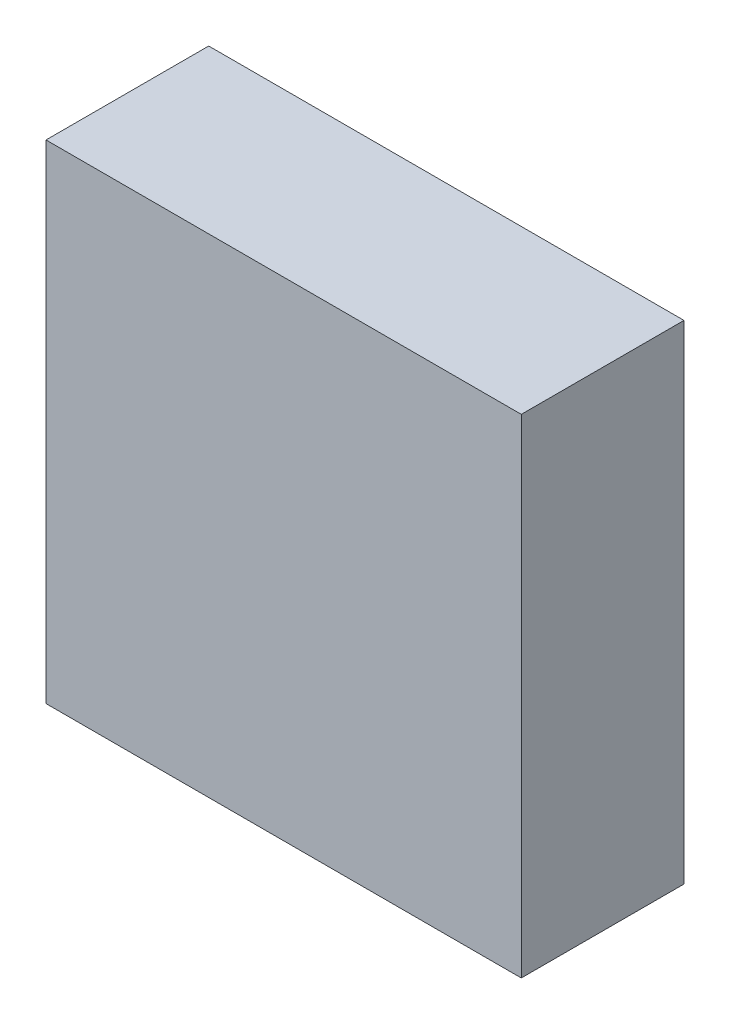
from build123d import *

# Parameters (mm, degrees)
SKETCH1_W               = 2.921
SKETCH1_H               = 3
COMPONENT_OUTLINE_DEPTH = 1


with BuildPart() as part:
    # Sketch1 → Component_Outline (new body)
    with BuildSketch(Plane.XY):
        with Locations((0.0381, 0)):
            Rectangle(SKETCH1_W, SKETCH1_H)
    extrude(amount=COMPONENT_OUTLINE_DEPTH)


solid = part.part
